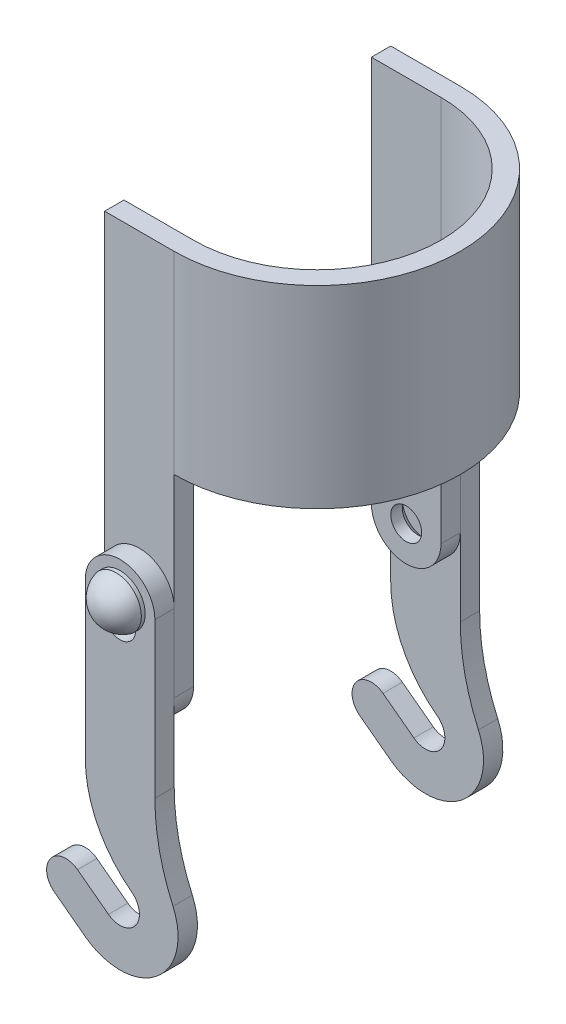
from build123d import *

# Parameters (mm, degrees)
BOSS_EXTRUDE1_DEPTH = 5
SKETCH3_R           = 4
BOSS_EXTRUDE2_DEPTH = 5
CHAMFER1_SIZE       = 2
SKETCH4_R           = 4
BOSS_EXTRUDE3_DEPTH = 10
SKETCH5_R           = 6.5
BOSS_EXTRUDE4_DEPTH = 1
DOME1_FACE_RADIUS   = 6.5
DOME1_HEIGHT        = 5
SKETCH6_R           = 6.5
BOSS_EXTRUDE5_DEPTH = 1
DOME2_FACE_RADIUS   = 6.5
DOME2_HEIGHT        = 5
BOSS_EXTRUDE6_DEPTH = 50


with BuildPart() as part:
    # Sketch2 → Boss-Extrude1 (new body)
    with BuildSketch(Plane(origin=(0, 5.818024311, 42), x_dir=(1, 0, 0), z_dir=(0, 0, 1))):
        with BuildLine():
            Line((-9, 45.940305938), (-9, 5.940305938))
            ThreePointArc((-9, 5.940305938), (-5.83281573, -7.476101927), (3, -18.059694062))
            ThreePointArc((3, -18.059694062), (4, -25.059694062), (-3, -26.059694062))
            Line((-3, -26.059694062), (-11, -20.059694062))
            ThreePointArc((-11, -20.059694062), (-18, -21.059694062), (-17, -28.059694062))
            Line((-17, -28.059694062), (-9, -34.059694062))
            ThreePointArc((-9, -34.059694062), (9.370425713, -33.772726203), (13.682926829, -15.913352598))
            ThreePointArc((13.682926829, -15.913352598), (10.183871249, -5.234578794), (9, 5.940305938))
            Line((9, 5.940305938), (9, 45.940305938))
            ThreePointArc((9, 45.940305938), (0, 54.940305938), (-9, 45.940305938))
        make_face()
        with BuildLine():
            Line((4, 45.940305938), (4, 40.940305938))
            ThreePointArc((4, 40.940305938), (0, 36.940305938), (-4, 40.940305938))
            Line((-4, 40.940305938), (-4, 45.940305938))
            ThreePointArc((-4, 45.940305938), (0, 49.940305938), (4, 45.940305938))
        make_face(mode=Mode.SUBTRACT)
    extrude(amount=-BOSS_EXTRUDE1_DEPTH)


with BuildPart() as body_2:
    # Sketch3 → Boss-Extrude2 (new body)
    with BuildSketch(Plane(origin=(0, 0, 37), x_dir=(-1, 0, 0), z_dir=(0, 0, -1))):
        with BuildLine():
            Line((9, 31.758330249), (9, 131.758330249))
            Line((9, 131.758330249), (-9, 131.758330249))
            Line((-9, 131.758330249), (-9, 31.758330249))
            ThreePointArc((-9, 31.758330249), (0, 22.758330249), (9, 31.758330249))
        make_face()
        with Locations((0, 51.758330249)):
            Circle(SKETCH3_R, mode=Mode.SUBTRACT)
        with Locations((0, 31.758330249)):
            Circle(SKETCH3_R, mode=Mode.SUBTRACT)
    extrude(amount=BOSS_EXTRUDE2_DEPTH)

    # Chamfer1
    chamfer1_edges = [body_2.edges().sort_by_distance(p)[0] for p in [
        (4, 31.758330249, 37),
    ]]
    chamfer(chamfer1_edges, length=CHAMFER1_SIZE)


with BuildPart() as body_3:
    # Sketch4 → Boss-Extrude3 (new body)
    with BuildSketch(Plane(origin=(0, 0, 32), x_dir=(-1, 0, 0), z_dir=(0, 0, -1))):
        with Locations((0, 51.758330249)):
            Circle(SKETCH4_R)
    extrude(amount=-BOSS_EXTRUDE3_DEPTH)

    # Sketch5 → Boss-Extrude4 (add)
    with BuildSketch(Plane.XY.offset(42)):
        with Locations((0, 51.758330249)):
            Circle(SKETCH5_R)
    extrude(amount=BOSS_EXTRUDE4_DEPTH)

    # Dome1: a dome of height H over a round flat face of radius A is a cap of a sphere of radius (A * A + H * H) / (2 * H)
    dome1_r = (DOME1_FACE_RADIUS * DOME1_FACE_RADIUS + DOME1_HEIGHT * DOME1_HEIGHT) / (2 * DOME1_HEIGHT)
    dome1_base = Plane((0, 51.758330249, 43), z_dir=(0, 0, 1))
    with Locations(dome1_base.offset(DOME1_HEIGHT - dome1_r)):
        dome1_ball = Sphere(dome1_r, mode=Mode.PRIVATE)
    add(split(dome1_ball, bisect_by=dome1_base, keep=Keep.TOP, mode=Mode.PRIVATE))

    # Sketch6 → Boss-Extrude5 (add)
    with BuildSketch(Plane(origin=(0, 0, 32), x_dir=(-1, 0, 0), z_dir=(0, 0, -1))):
        with Locations(Location((0, 51.758330249, 0), (0, 0, 180))):
            Circle(SKETCH6_R)
    extrude(amount=BOSS_EXTRUDE5_DEPTH)

    # Dome2: a dome of height H over a round flat face of radius A is a cap of a sphere of radius (A * A + H * H) / (2 * H)
    dome2_r = (DOME2_FACE_RADIUS * DOME2_FACE_RADIUS + DOME2_HEIGHT * DOME2_HEIGHT) / (2 * DOME2_HEIGHT)
    dome2_base = Plane((0, 51.758330249, 31), z_dir=(0, 0, -1))
    with Locations(dome2_base.offset(DOME2_HEIGHT - dome2_r)):
        dome2_ball = Sphere(dome2_r, mode=Mode.PRIVATE)
    add(split(dome2_ball, bisect_by=dome2_base, keep=Keep.TOP, mode=Mode.PRIVATE))


with BuildPart() as body_4:
    # Mirror2: mirrored copy
    add(part.part.mirror(Plane.XY))


with BuildPart() as body_5:
    # Mirror2 2: mirrored copy
    add(body_2.part.mirror(Plane.XY))


with BuildPart() as body_6:
    # Mirror2 3: mirrored copy
    add(body_3.part.mirror(Plane.XY))


with BuildPart() as body_2_1:
    add(body_2.part)

    add(body_5.part)  # Boss-Extrude6 merges body 5
    # Sketch7 → Boss-Extrude6 (add)
    with BuildSketch(Plane(origin=(0, 131.758330249, 0), x_dir=(1, 0, 0), z_dir=(0, 1, 0))):
        with BuildLine():
            Line((-9, -37), (9, -37))
            ThreePointArc((9, -37), (46, 0), (9, 37))
            Line((9, 37), (-9, 37))
            Line((-9, 37), (-9, 32))
            Line((-9, 32), (9, 32))
            ThreePointArc((9, 32), (41, 0), (9, -32))
            Line((9, -32), (-9, -32))
            Line((-9, -32), (-9, -37))
        make_face()
    extrude(amount=-BOSS_EXTRUDE6_DEPTH)


solid = Compound([part.part, body_3.part, body_4.part, body_6.part, body_2_1.part])
